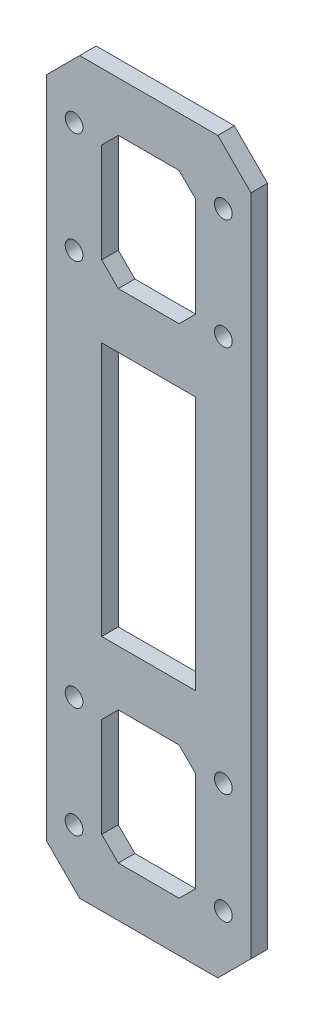
from build123d import *

# Parameters (mm, degrees)
SKETCH_1_W          = 37
SKETCH_1_H          = 120
SKETCH_1_R          = 1.6
EXTRUDE_1_DEPTH     = 3
SKETCH_2_W          = 17
SKETCH_2_H          = 24
CUT_EXTRUDE_1_DEPTH = 126.610509114
SKETCH_3_W          = 37
SKETCH_3_H          = 6
EXTRUDE_2_DEPTH     = 3
CHAMFER_1_SIZE      = 6
CHAMFER_2_SIZE      = 3
SKETCH_4_W          = 17
SKETCH_4_H          = 46
CUT_EXTRUDE_2_DEPTH = 10


with BuildPart() as part:
    # ｽｹｯﾁ1 → ﾎﾞｽ - 押し出し1 (new body)
    with BuildSketch(Plane.XY):
        with Locations((18.5, 60)):
            Rectangle(SKETCH_1_W, SKETCH_1_H)
        with Locations((5, 115)):
            Circle(SKETCH_1_R, mode=Mode.SUBTRACT)
        with Locations((32, 115)):
            Circle(SKETCH_1_R, mode=Mode.SUBTRACT)
        with Locations((5, 95)):
            Circle(SKETCH_1_R, mode=Mode.SUBTRACT)
        with Locations((32, 95)):
            Circle(SKETCH_1_R, mode=Mode.SUBTRACT)
        with Locations((5, 25)):
            Circle(SKETCH_1_R, mode=Mode.SUBTRACT)
        with Locations((32, 25)):
            Circle(SKETCH_1_R, mode=Mode.SUBTRACT)
        with Locations((5, 5)):
            Circle(SKETCH_1_R, mode=Mode.SUBTRACT)
        with Locations((32, 5)):
            Circle(SKETCH_1_R, mode=Mode.SUBTRACT)
    extrude(amount=EXTRUDE_1_DEPTH)

    # ｽｹｯﾁ2 → ｶｯﾄ - 押し出し1 (cut, through all)
    with BuildSketch(Plane.XY.offset(3)):
        with Locations((18.5, 105)):
            Rectangle(SKETCH_2_W, SKETCH_2_H)
        with Locations((18.5, 15)):
            Rectangle(SKETCH_2_W, SKETCH_2_H)
    extrude(amount=-CUT_EXTRUDE_1_DEPTH, mode=Mode.SUBTRACT)

    # ｽｹｯﾁ3 → ﾎﾞｽ - 押し出し2 (add)
    with BuildSketch(Plane.XY.offset(3)):
        with Locations((18.5, 123)):
            Rectangle(SKETCH_3_W, SKETCH_3_H)
        with Locations((18.5, -3)):
            Rectangle(SKETCH_3_W, SKETCH_3_H)
    extrude(amount=-EXTRUDE_2_DEPTH)

    # 面取り1
    chamfer_1_edges = [part.edges().sort_by_distance(p)[0] for p in [
        (0, 126, 1.5),
        (37, 126, 1.5),
        (0, -6, 1.5),
        (37, -6, 1.5),
    ]]
    chamfer(chamfer_1_edges, length=CHAMFER_1_SIZE)

    # 面取り2
    chamfer_2_edges = [part.edges().sort_by_distance(p)[0] for p in [
        (10, 93, 1.5),
        (10, 117, 1.5),
        (27, 117, 1.5),
        (27, 93, 1.5),
        (10, 3, 1.5),
        (10, 27, 1.5),
        (27, 27, 1.5),
        (27, 3, 1.5),
    ]]
    chamfer(chamfer_2_edges, length=CHAMFER_2_SIZE)

    # ｽｹｯﾁ4 → ｶｯﾄ - 押し出し2 (cut)
    with BuildSketch(Plane.XY.offset(3)):
        with Locations((18.5, 60)):
            Rectangle(SKETCH_4_W, SKETCH_4_H)
    extrude(amount=-CUT_EXTRUDE_2_DEPTH, mode=Mode.SUBTRACT)


solid = part.part
